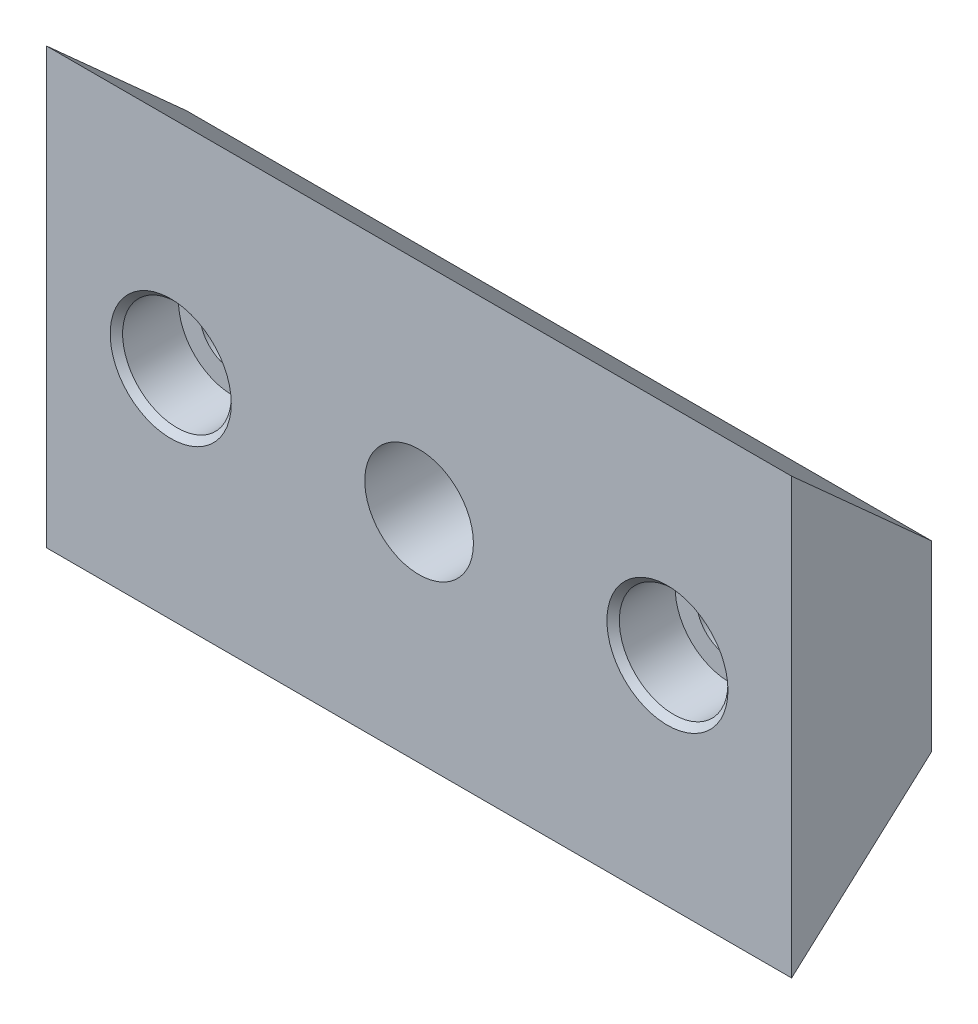
from build123d import *

# Parameters (mm, degrees)
BOSS_EXTRUDE1_DEPTH                           = 76.2
CBORE_FOR_1_4_SOCKET_HEAD_CAP_SCREW1_AT_COUNT = 2
CBORE_FOR_1_4_SOCKET_HEAD_CAP_SCREW1_AT_PITCH = 50.8
F_7_16_0_4375_DIAMETER_HOLE1_D                = 11.1125


with BuildPart() as part:
    # Sketch2 → Boss-Extrude1 (new body)
    with BuildSketch(Plane(origin=(0, 0, 0), x_dir=(0, 0, -1), z_dir=(1, 0, 0))):
        Polygon((0, 0), (0, 44.45), (14.3002, 31.574042086), (14.3002, 12.875957914), align=None)
    extrude(amount=-BOSS_EXTRUDE1_DEPTH)

    # Sketch3 → CBORE for 1/4 Socket Head Cap Screw1 (revolve, cut)
    with BuildSketch(Plane(origin=(-63.5, 22.225, 0), x_dir=(0, -1, 0), z_dir=(1, 0, 0))):
        Polygon((0, 0), (0, 14.3002), (3.3782, 14.3002), (3.3782, 6.35), (5.55625, 6.35), (5.55625, 0.635), (6.19125, 0), align=None)
    cbore_for_1_4_socket_head_cap_screw1 = revolve(axis=Axis((-63.5, 22.225, 6.35), (0, 0, -1)), mode=Mode.SUBTRACT)

    # CBORE for 1/4 Socket Head Cap Screw1 at: CBORE for 1/4 Socket Head Cap Screw1 ×2
    with Locations(*[(i * CBORE_FOR_1_4_SOCKET_HEAD_CAP_SCREW1_AT_PITCH, 0, 0) for i in range(1, CBORE_FOR_1_4_SOCKET_HEAD_CAP_SCREW1_AT_COUNT)]):
        add(cbore_for_1_4_socket_head_cap_screw1, mode=Mode.SUBTRACT)

    # 7/16 (0.4375) Diameter Hole1 (through all)
    with Locations(Plane.XY):
        with Locations((-38.1, 22.225)):
            Hole(F_7_16_0_4375_DIAMETER_HOLE1_D / 2)


solid = part.part
